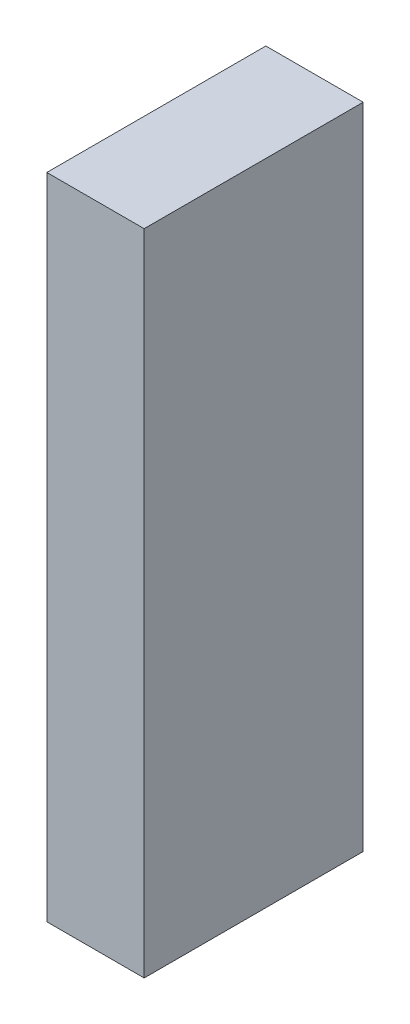
from build123d import *

# Parameters (mm, degrees)
PROFILE_SKETCH_W      = 6
PROFILE_SKETCH_H      = 13.5
PROFILE_EXTRUDE_DEPTH = 40


with BuildPart() as part:
    # Profile Sketch → Profile Extrude (new body)
    with BuildSketch(Plane(origin=(-13.83405858, 0, -105.75669297), x_dir=(-1, 0, 0), z_dir=(0, 1, 0))):
        with Locations((0, 6.75)):
            Rectangle(PROFILE_SKETCH_W, PROFILE_SKETCH_H)
    extrude(amount=PROFILE_EXTRUDE_DEPTH)


solid = part.part
